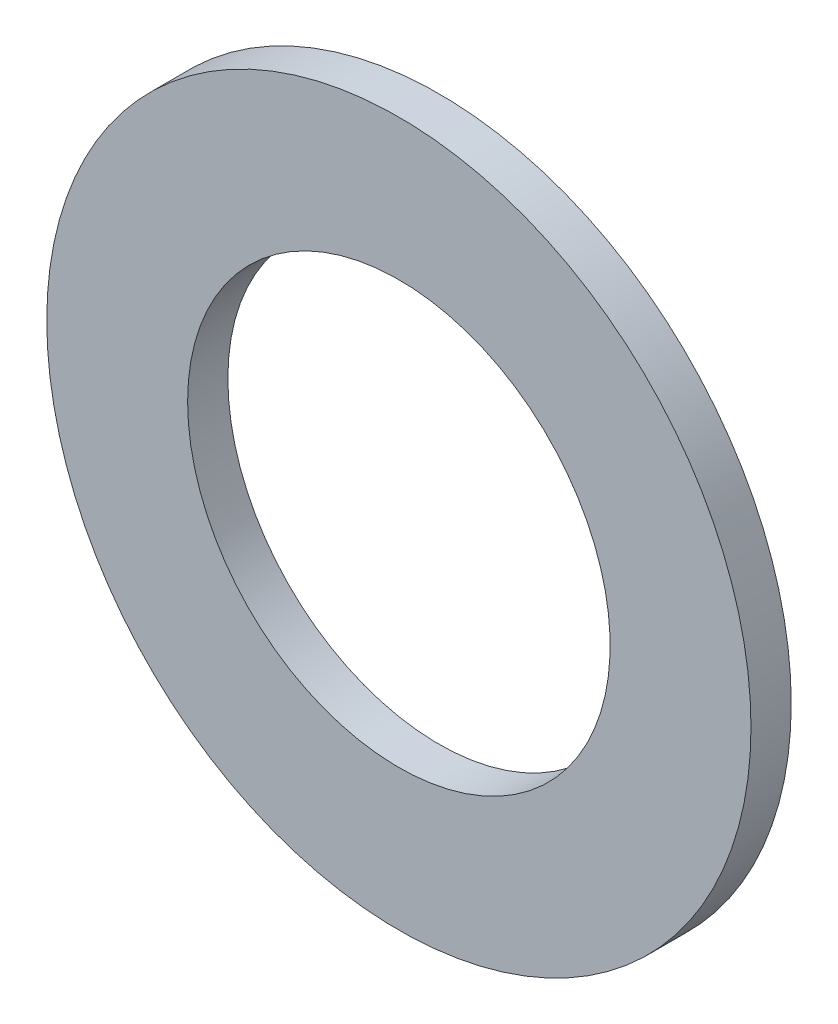
from build123d import *

# Parameters (mm, degrees)
ESQUISSE1_R        = 17.5
ESQUISSE1_R_2      = 10.5
BOSS_EXTRU_1_DEPTH = 2


with BuildPart() as part:
    # Esquisse1 → Boss.-Extru.1 (new body)
    with BuildSketch(Plane.XY):
        with Locations(Location((0, 0, 0), (0, 0, 180))):
            Circle(ESQUISSE1_R)
        with Locations(Location((0, 0, 0), (0, 0, 180))):
            Circle(ESQUISSE1_R_2, mode=Mode.SUBTRACT)
    extrude(amount=BOSS_EXTRU_1_DEPTH)


solid = part.part
